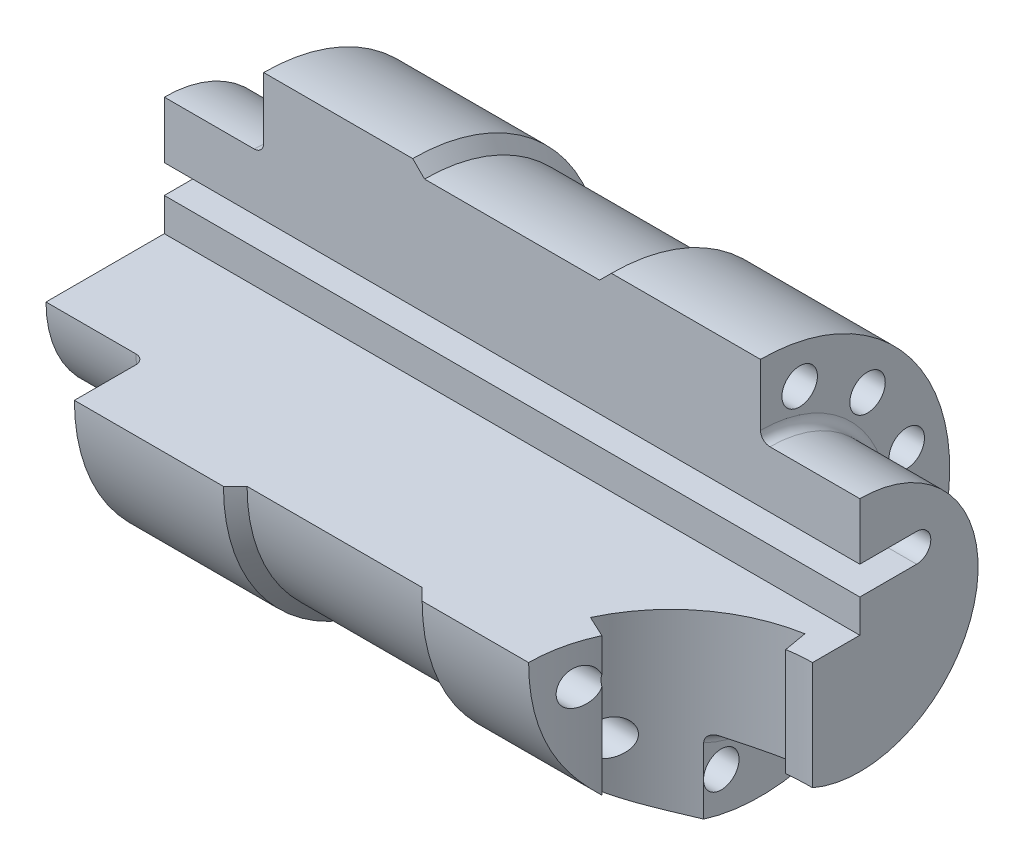
from build123d import *

# Parameters (mm, degrees)
R_VOLUTION1_ANGLE            = 270
ENL_V_MAT_EXTRU_1_DEPTH      = 158.508729917
ENL_V_MAT_EXTRU_1_DEPTH_BACK = 158.508729917
CONG_1_R                     = 2
ESQUISSE6_R                  = 3.75
ENL_V_MAT_EXTRU_2_DEPTH      = 139.115893365
R_P_TITION_CIRCULAIRE2_COUNT = 12
ENL_V_MAT_EXTRU_3_DEPTH      = 131.613532807
ENL_V_MAT_EXTRU_3_DEPTH_BACK = 131.613532807
ESQUISSE9_R                  = 30
ENL_V_MAT_EXTRU_4_DEPTH      = 158.508730061
ENL_V_MAT_EXTRU_4_DEPTH_BACK = 10
CONG_2_R                     = 1


with BuildPart() as part:
    # Esquisse1 → Révolution1 (revolve)
    with BuildSketch(Plane.XY):
        Polygon((0, 0), (-117.728055077, 0), (-117.728055077, 25), (-96.728055077, 25), (-96.728055077, 40), (-65.228055077, 40), (-62.728055077, 37.5), (-25.728055077, 37.5), (-23.228055077, 40), (8.271944923, 40), (8.271944923, 25), (29.271944923, 25), (29.271944923, 0), align=None)
    revolve(axis=Axis((0, 0, 0), (-1, 0, 0)), revolution_arc=R_VOLUTION1_ANGLE)

    # Esquisse3 → Enlèv. mat.-Extru.1 (cut, two sides: drawn at the far end of the back side and taken through both)
    with BuildSketch(Plane.ZY.offset(117.728055077).offset(-ENL_V_MAT_EXTRU_1_DEPTH_BACK)):
        with BuildLine():
            Line((-12, 13), (0, 13))
            ThreePointArc((0, 13), (3, 10), (0, 7))
            Line((0, 7), (-12, 7))
            ThreePointArc((-12, 7), (-15, 10), (-12, 13))
        make_face()
    extrude(amount=ENL_V_MAT_EXTRU_1_DEPTH + ENL_V_MAT_EXTRU_1_DEPTH_BACK, mode=Mode.SUBTRACT)

    # Congé1
    cong_1_edges = [part.edges().sort_by_distance(p)[0] for p in [
        (8.271944923, -17.67766953, -17.67766953),
        (-96.728055077, -17.67766953, -17.67766953),
    ]]
    fillet(cong_1_edges, radius=CONG_1_R)

    # Esquisse6 → Enlèv. mat.-Extru.2 (cut, symmetric)
    with BuildSketch(Plane.ZY.offset(96.728055077)):
        with Locations((-8.282209443, 30.909626441)):
            Circle(ESQUISSE6_R)
    enl_v_mat_extru_2 = extrude(amount=ENL_V_MAT_EXTRU_2_DEPTH, both=True, mode=Mode.SUBTRACT)

    # Répétition circulaire2: Enlèv. mat.-Extru.2 ×12 about axis
    r_p_tition_circulaire2_axis = Axis((0, 0, 0), (1, 0, 0))
    for i in range(1, R_P_TITION_CIRCULAIRE2_COUNT):
        add(enl_v_mat_extru_2.rotate(r_p_tition_circulaire2_axis, i * 360 / R_P_TITION_CIRCULAIRE2_COUNT), mode=Mode.SUBTRACT)

    # Esquisse9 → Enlèv. mat.-Extru.3 (cut, two sides: drawn at the far end of the back side and taken through both)
    with BuildSketch(Plane(origin=(0, 0, 0), x_dir=(1, 0, 0), z_dir=(0, 1, 0)).offset(-ENL_V_MAT_EXTRU_3_DEPTH_BACK)):
        with Locations((29.271944923, -40)):
            Circle(ESQUISSE9_R)
        with BuildLine():
            Line((29.271944923, -40), (23.194258704, -5.531728645))
            ThreePointArc((23.194258704, -5.531728645), (7.965294907, -12.23263309), (-2.448827624, -25.208360839))
            Line((-2.448827624, -25.208360839), (29.271944923, -40))
        make_face()
        with BuildLine():
            Line((29.271944923, -10), (29.271944923, -25))
            Line((29.271944923, -25), (29.271944923, -40))
            Line((29.271944923, -40), (8.271944923, -40))
            Line((8.271944923, -40), (-0.728055077, -40))
            ThreePointArc((-0.728055077, -40), (29.271944923, -70), (59.271944923, -40))
            ThreePointArc((59.271944923, -40), (50.485148358, -18.786796564), (29.271944923, -10))
        make_face()
        with BuildLine():
            Line((-0.728055077, -40), (8.271944923, -40))
            Line((8.271944923, -40), (8.271944923, -30.207539179))
            Line((8.271944923, -30.207539179), (2.082711311, -27.321452148))
            ThreePointArc((2.082711311, -27.321452148), (-0.016935291, -33.506811582), (-0.728055077, -40))
        make_face()
        with BuildLine():
            Line((26.627040212, -25), (29.271944923, -25))
            Line((29.271944923, -25), (29.271944923, -10))
            ThreePointArc((29.271944923, -10), (26.65727264, -10.114159057), (24.062499593, -10.45576741))
            Line((24.062499593, -10.45576741), (26.627040212, -25))
        make_face()
        with BuildLine():
            Line((10.271944923, -25), (26.627040212, -25))
            Line((26.627040212, -25), (24.062499593, -10.45576741))
            ThreePointArc((24.062499593, -10.45576741), (11.009102052, -16.199399791), (2.082711311, -27.321452148))
            Line((2.082711311, -27.321452148), (8.271944923, -30.207539179))
            Line((8.271944923, -30.207539179), (8.271944923, -27))
            ThreePointArc((8.271944923, -27), (8.85773136, -25.585786438), (10.271944923, -25))
        make_face()
    extrude(amount=ENL_V_MAT_EXTRU_3_DEPTH + ENL_V_MAT_EXTRU_3_DEPTH_BACK, mode=Mode.SUBTRACT)

    # Esquisse10 → Enlèv. mat.-Extru.4 (cut, two sides: drawn at the far end of the back side and taken through both)
    with BuildSketch(Plane.ZY.offset(117.728055077).offset(-ENL_V_MAT_EXTRU_4_DEPTH_BACK)):
        with BuildLine():
            Line((-4.776313653, 3), (-19.908574626, 3))
            ThreePointArc((-19.908574626, 3), (-3.674077438, -18.363865829), (18.989837064, -4))
            Line((18.989837064, -4), (-4.776313653, -4))
            Line((-4.776313653, -4), (-4.776313653, 3))
        make_face()
    extrude(amount=ENL_V_MAT_EXTRU_4_DEPTH + ENL_V_MAT_EXTRU_4_DEPTH_BACK, mode=Mode.SUBTRACT)

    # Congé2
    cong_2_edges = [part.edges().sort_by_distance(p)[0] for p in [
        (-107.728055077, 3, -12.342444139),
        (-107.728055077, -18.363865829, -3.674077438),
        (-107.728055077, -0.5, -4.776313653),
        (-107.728055077, -4, 7.106761705),
    ]]
    fillet(cong_2_edges, radius=CONG_2_R)


solid = part.part
